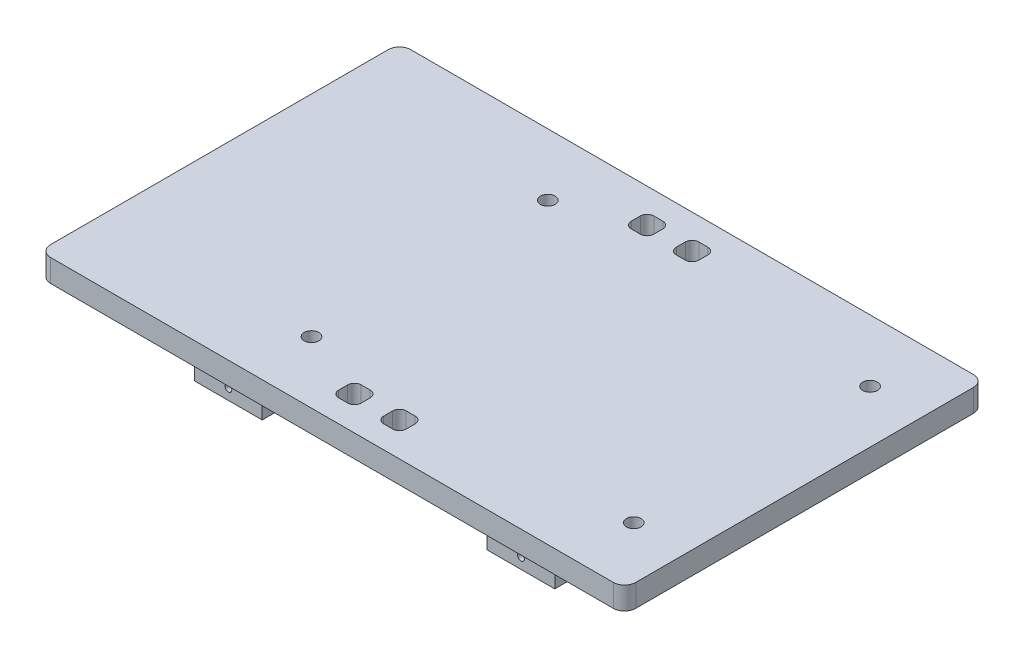
from build123d import *

# Parameters (mm, degrees)
SKETCH1_W           = 260
SKETCH1_H           = 160
BOSS_EXTRUDE1_DEPTH = 10
SKETCH2_W           = 30
SKETCH2_H           = 10
BOSS_EXTRUDE2_DEPTH = 22
SKETCH3_R           = 1.5
CUT_EXTRUDE1_DEPTH  = 112
SKETCH4_W           = 30
SKETCH4_H           = 2.519449054
BOSS_EXTRUDE3_DEPTH = 10
SKETCH5_R           = 3.25
CUT_EXTRUDE4_DEPTH  = 10
SKETCH7_W           = 10
SKETCH7_H           = 10
CUT_EXTRUDE5_DEPTH  = 10
FILLET1_R           = 5
FILLET2_R           = 3


with BuildPart() as part:
    # Sketch1 → Boss-Extrude1 (new body)
    with BuildSketch(Plane(origin=(0, 0, 0), x_dir=(1, 0, 0), z_dir=(0, 1, 0))):
        Rectangle(SKETCH1_W, SKETCH1_H)
    extrude(amount=BOSS_EXTRUDE1_DEPTH)

    # Sketch2 → Boss-Extrude2 (add)
    with BuildSketch(Plane.XZ):
        with Locations((-65, 56)):
            Rectangle(SKETCH2_W, SKETCH2_H)
        with Locations((65, 56)):
            Rectangle(SKETCH2_W, SKETCH2_H)
        with Locations((65, -56)):
            Rectangle(SKETCH2_W, SKETCH2_H)
        with Locations((-65, -56)):
            Rectangle(SKETCH2_W, SKETCH2_H)
    extrude(amount=BOSS_EXTRUDE2_DEPTH)

    # Sketch3 → Cut-Extrude1 (cut)
    with BuildSketch(Plane.XY.offset(61)):
        with Locations((-65, -2.25)):
            Circle(SKETCH3_R)
        with Locations(Location((-65, -19.75, 0), (0, 0, 180))):
            Circle(SKETCH3_R)
        with Locations((65, -19.75)):
            Circle(SKETCH3_R)
        with Locations(Location((65, -2.25, 0), (0, 0, 180))):
            Circle(SKETCH3_R)
    cut_extrude1 = extrude(amount=-CUT_EXTRUDE1_DEPTH, mode=Mode.SUBTRACT)

    # Mirror1: Cut-Extrude1 across plane
    add(cut_extrude1.mirror(Plane.XY), mode=Mode.SUBTRACT)

    # Sketch4 → Boss-Extrude3 (add)
    with BuildSketch(Plane.XY.offset(61)):
        with Locations((-65, -23.259724527)):
            Rectangle(SKETCH4_W, SKETCH4_H)
        with Locations((65, -23.259724527)):
            Rectangle(SKETCH4_W, SKETCH4_H)
    boss_extrude3 = extrude(amount=-BOSS_EXTRUDE3_DEPTH)

    # Mirror3: Boss-Extrude3 across plane
    add(boss_extrude3.mirror(Plane.XY))

    # Sketch5 → Cut-Extrude4 (cut)
    with BuildSketch(Plane(origin=(0, 10, 0), x_dir=(1, 0, 0), z_dir=(0, 1, 0))):
        with Locations(Location((-36.593545043, 52.5, 0), (0, 0, 270))):
            Circle(SKETCH5_R)
        with Locations(Location((106.593545043, 52.5, 0), (0, 0, 270))):
            Circle(SKETCH5_R)
        with Locations(Location((-36.593545043, -52.5, 0), (0, 0, 270))):
            Circle(SKETCH5_R)
        with Locations(Location((106.593545043, -52.5, 0), (0, 0, 270))):
            Circle(SKETCH5_R)
    extrude(amount=-CUT_EXTRUDE4_DEPTH, mode=Mode.SUBTRACT)

    # Sketch7 → Cut-Extrude5 (cut)
    with BuildSketch(Plane(origin=(0, 10, 0), x_dir=(1, 0, 0), z_dir=(0, 1, 0))):
        with Locations((-5, 65)):
            Rectangle(SKETCH7_W, SKETCH7_H)
        with Locations((15, 65)):
            Rectangle(SKETCH7_W, SKETCH7_H)
    cut_extrude5 = extrude(amount=-CUT_EXTRUDE5_DEPTH, mode=Mode.SUBTRACT)

    # Mirror4: Cut-Extrude5 across plane
    add(cut_extrude5.mirror(Plane(origin=(0, 0, 0), x_dir=(1, 0, 0), z_dir=(0, 0, -1))), mode=Mode.SUBTRACT)

    # Fillet1
    fillet1_edges = [part.edges().sort_by_distance(p)[0] for p in [
        (130, 5, 80),
        (-130, 5, 80),
        (-130, 5, -80),
        (130, 5, -80),
    ]]
    fillet(fillet1_edges, radius=FILLET1_R)

    # Fillet2
    fillet2_edges = [part.edges().sort_by_distance(p)[0] for p in [
        (-10, 5, -60),
        (-10, 5, -70),
        (0, 5, -70),
        (0, 5, -60),
        (20, 5, -60),
        (10, 5, -60),
        (10, 5, -70),
        (20, 5, -70),
        (0, 5, 70),
        (0, 5, 60),
        (-10, 5, 60),
        (-10, 5, 70),
        (10, 5, 70),
        (20, 5, 70),
        (20, 5, 60),
        (10, 5, 60),
    ]]
    fillet(fillet2_edges, radius=FILLET2_R)


solid = part.part
